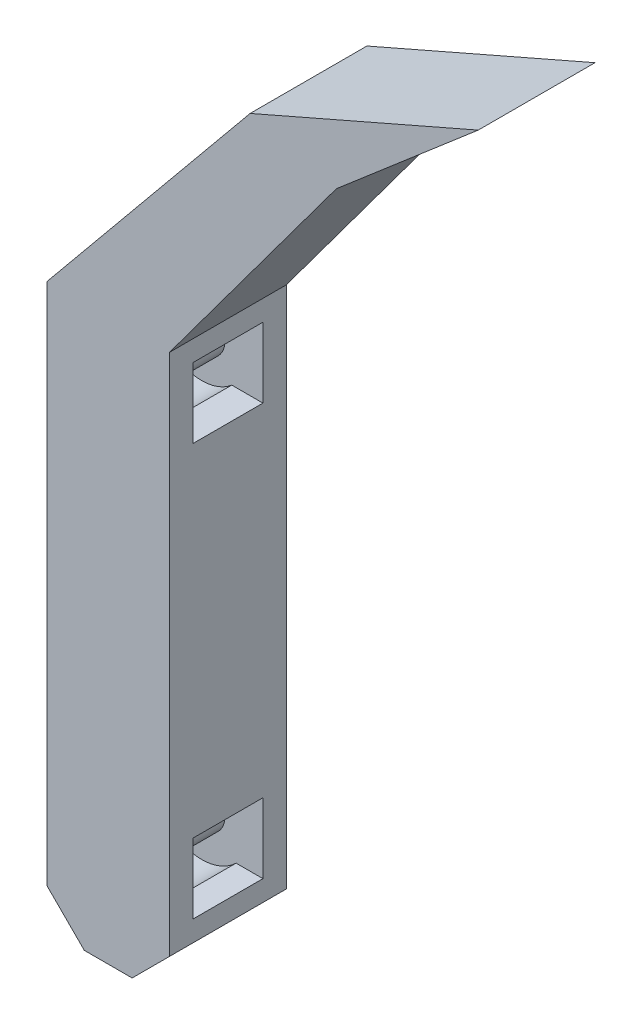
from build123d import *

# Parameters (mm, degrees)
SKETCH_1_W          = 26.239617318
SKETCH_1_H          = 120
EXTRUDE_1_DEPTH     = 25
CHAMFER_1_SIZE      = 8
SKETCH_3_W          = 15
SKETCH_3_H          = 15
CUT_EXTRUDE_4_DEPTH = 35
SKETCH_4_R          = 5
EXTRUDE_2_DEPTH     = 15
SKETCH_5_R          = 10.513466809
SKETCH_5_R_2        = 5
CUT_EXTRUDE_5_DEPTH = 15
SKETCH_6_W          = 15
SKETCH_6_H          = 15
CUT_EXTRUDE_6_DEPTH = 188.870930903
SKETCH_7_R          = 5
EXTRUDE_3_DEPTH     = 15
SKETCH_8_R          = 5
CUT_EXTRUDE_9_DEPTH = 15


with BuildPart() as part:
    # 草图1 → 凸台-拉伸1 (new body)
    with BuildSketch(Plane.XY):
        with Locations((3.568688241, 27.453328425)):
            Rectangle(SKETCH_1_W, SKETCH_1_H)
        Polygon((52.421783721, 135.65221029), (16.6884969, 87.453328425), (-9.551120418, 87.453328425), (33.944293966, 140.364941184), (82.783975756, 161.693279677), align=None)
    extrude(amount=EXTRUDE_1_DEPTH)

    # 倒角1
    chamfer_1_edges = [part.edges().sort_by_distance(p)[0] for p in [
        (16.6884969, -32.546671575, 12.5),
        (-9.551120418, -32.546671575, 12.5),
    ]]
    chamfer(chamfer_1_edges, length=CHAMFER_1_SIZE)

    # 草图3 → 切除-拉伸4 (cut)
    with BuildSketch(Plane.ZY.offset(9.551120418)):
        with Locations((12.5, -12.627226007)):
            Rectangle(SKETCH_3_W, SKETCH_3_H)
    extrude(amount=-CUT_EXTRUDE_4_DEPTH, mode=Mode.SUBTRACT)

    # 草图4 → 凸台-拉伸2 (add)
    with BuildSketch(Plane.XY.offset(5)):
        with Locations(Location((3.568688241, -12.627226007, 0), (0, 0, 180))):
            Circle(SKETCH_4_R)
    extrude(amount=EXTRUDE_2_DEPTH)

    # 草图5 → 切除-拉伸5 (cut)
    with BuildSketch(Plane.XY.offset(5)):
        with Locations((3.568688241, -12.627226007)):
            Circle(SKETCH_5_R)
        with Locations(Location((3.568688241, -12.627226007, 0), (0, 0, 180))):
            Circle(SKETCH_5_R_2, mode=Mode.SUBTRACT)
    extrude(amount=CUT_EXTRUDE_5_DEPTH, mode=Mode.SUBTRACT)

    # 草图6 → 切除-拉伸6 (cut, through all)
    with BuildSketch(Plane.ZY.offset(9.551120418)):
        with Locations((12.5, 75.533882858)):
            Rectangle(SKETCH_6_W, SKETCH_6_H)
    extrude(amount=-CUT_EXTRUDE_6_DEPTH, mode=Mode.SUBTRACT)

    # 草图7 → 凸台-拉伸3 (add)
    with BuildSketch(Plane.XY.offset(5)):
        with Locations(Location((3.568688241, 75.533882858, 0), (0, 0, 180))):
            Circle(SKETCH_7_R)
    extrude(amount=EXTRUDE_3_DEPTH)

    # 草图8 → 切除-拉伸9 (cut)
    # profile 1 of 3: a face of its own
    with BuildSketch(Plane.XY.offset(5)):
        with BuildLine():
            ThreePointArc((13.459511585, 75.533882858), (12.557728949, 79.660083722), (10.016818701, 83.033882858))
            Line((10.016818701, 83.033882858), (-2.879442218, 83.033882858))
            ThreePointArc((-2.879442218, 83.033882858), (-6.322135103, 75.533882858), (-2.879442218, 68.033882858))
            Line((-2.879442218, 68.033882858), (10.016818701, 68.033882858))
            ThreePointArc((10.016818701, 68.033882858), (12.557728949, 71.407681993), (13.459511585, 75.533882858))
        make_face()
        with Locations(Location((3.568688241, 75.533882858, 0), (0, 0, 180))):
            Circle(SKETCH_8_R, mode=Mode.SUBTRACT)
    # profile 2 of 3: a face of its own
    with BuildSketch(Plane.XY.offset(5)):
        with BuildLine():
            Line((-2.879442218, 83.033882858), (10.016818701, 83.033882858))
            ThreePointArc((10.016818701, 83.033882858), (3.568688241, 85.424706202), (-2.879442218, 83.033882858))
        make_face()
    # profile 3 of 3: a face of its own
    with BuildSketch(Plane.XY.offset(5)):
        with BuildLine():
            ThreePointArc((-2.879442218, 68.033882858), (3.568688241, 65.643059514), (10.016818701, 68.033882858))
            Line((10.016818701, 68.033882858), (-2.879442218, 68.033882858))
        make_face()
    extrude(amount=CUT_EXTRUDE_9_DEPTH, mode=Mode.SUBTRACT)


solid = part.part
